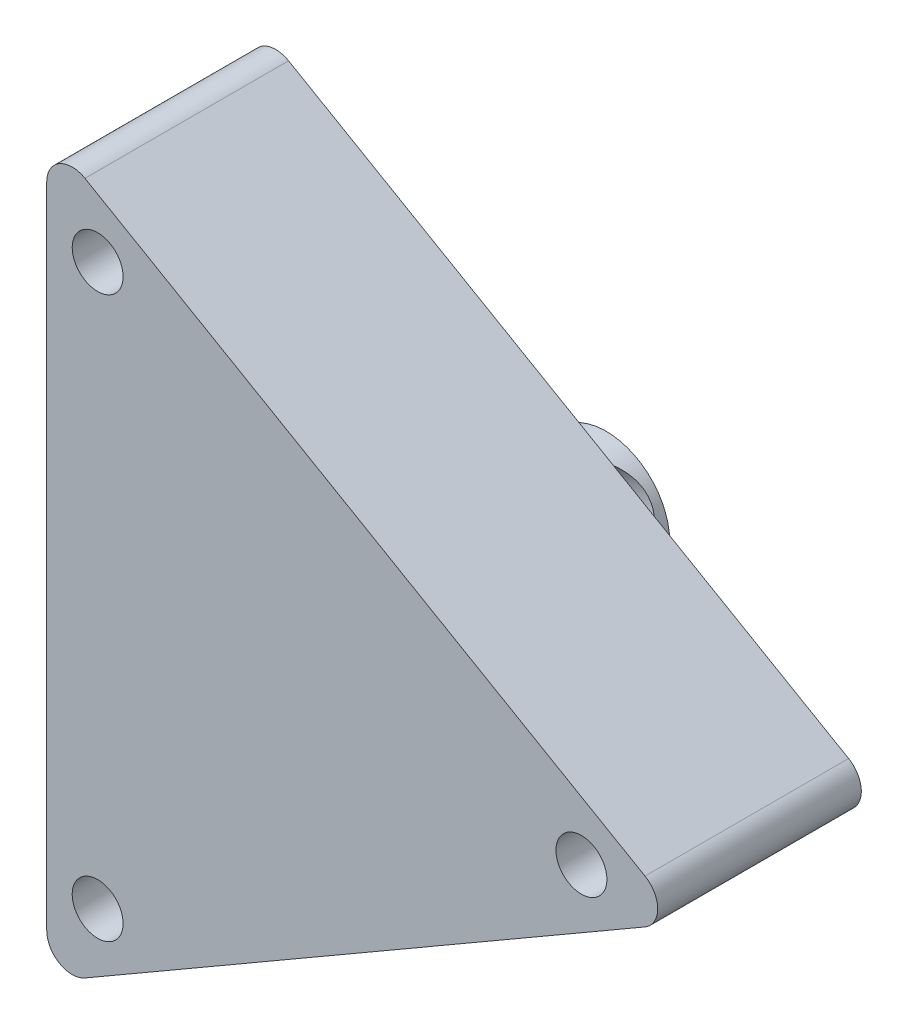
from build123d import *

# Parameters (mm, degrees)
Y_KSEKLIK_EKSTR_ZYON1_DEPTH = 16
IZIM2_W                     = 5
IZIM2_H                     = 10
F_4_0_4_AP_DELIK1_D         = 4
M8_BO_LUKLU_DELIK1_D        = 8.55
M8_BO_LUKLU_DELIK1_DEPTH    = 34.043716459


with BuildPart() as part:
    # Çizim1 → Yükseklik-Ekstrüzyon1 (new body)
    with BuildSketch(Plane(origin=(0, 0, 0), x_dir=(-1, 0, 0), z_dir=(0, 0, -1))):
        with BuildLine():
            Line((24.144741863, 27.209326424), (-19.863531155, 1.730852571))
            ThreePointArc((-19.863531155, 1.730852571), (-20.861458614, 0), (-19.863531155, -1.730852571))
            Line((-19.863531155, -1.730852571), (24.144741863, -27.209326424))
            ThreePointArc((24.144741863, -27.209326424), (26.145777596, -27.211122848), (27.146814404, -25.478473853))
            Line((27.146814404, -25.478473853), (27.146814404, 25.478473853))
            ThreePointArc((27.146814404, 25.478473853), (26.145777596, 27.211122848), (24.144741863, 27.209326424))
        make_face()
    extrude(amount=-Y_KSEKLIK_EKSTR_ZYON1_DEPTH)

    # Çizim2 → Döndür1 (revolve)
    with BuildSketch(Plane(origin=(0, -0.521526147, 0), x_dir=(1, 0, 0), z_dir=(0, 1, 0))):
        with Locations((-6.693456416, 5)):
            Rectangle(IZIM2_W, IZIM2_H)
    revolve(axis=Axis((-9.193456416, -0.521526147, -10), (0, 0, 1)))

    # Ø4.0 (4) Çap Delik1 (through all)
    with Locations(Plane(origin=(0, 0, 0), x_dir=(-1, 0, 0), z_dir=(0, 0, -1))):
        with Locations((23.146814404, -22.009579284), (-14.869731632, 0), (23.146814404, 22.009579284)):
            Hole(F_4_0_4_AP_DELIK1_D / 2)

    # M8 Boşluklu Delik1
    with Locations(Plane(origin=(-2.784563035, -1.612115441, 0), x_dir=(0, 0, -1), z_dir=(0.8654262854811261, 0.501036270541705, 0))):
        with Locations((5, 4.433526161)):
            Hole(M8_BO_LUKLU_DELIK1_D / 2, depth=M8_BO_LUKLU_DELIK1_DEPTH)


solid = part.part
